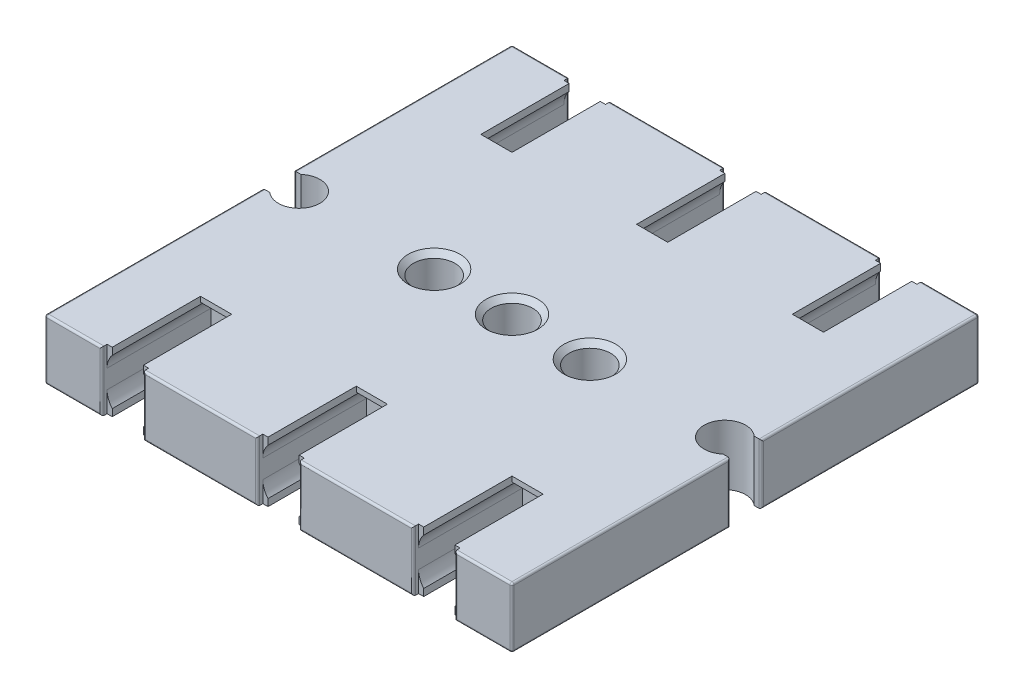
from build123d import *

# Parameters (mm, degrees)
SKETCH_1_W                       = 45
SKETCH_1_H                       = 45
EXTRUDE_1_DEPTH                  = 5.8
CUT_EXTRUDE_1_DEPTH              = 10.5
SKETCH_3_W                       = 4
SKETCH_3_H                       = 5.8
CUT_EXTRUDE_2_DEPTH              = 0.5
SKETCH_4_W                       = 3
SKETCH_4_H                       = 0.5
EXTRUDE_2_DEPTH                  = 1.5
PATTERN_LINEAR_1_COUNT           = 3
PATTERN_LINEAR_1_PITCH           = 15
PATTERN_LINEAR_1_COPY_1_DEPTH    = 10.5
PATTERN_LINEAR_1_COPY_2_DEPTH    = 10.5
PATTERN_LINEAR_1_COPY_3_SKETCH_W = 4
PATTERN_LINEAR_1_COPY_3_SKETCH_H = 5.8
PATTERN_LINEAR_1_COPY_3_DEPTH    = 0.5
PATTERN_LINEAR_1_COPY_4_SKETCH_W = 4
PATTERN_LINEAR_1_COPY_4_SKETCH_H = 5.8
PATTERN_LINEAR_1_COPY_4_DEPTH    = 0.5
PATTERN_LINEAR_1_COPY_5_SKETCH_W = 3
PATTERN_LINEAR_1_COPY_5_SKETCH_H = 0.5
PATTERN_LINEAR_1_COPY_5_DEPTH    = 1.5
PATTERN_LINEAR_1_COPY_6_SKETCH_W = 3
PATTERN_LINEAR_1_COPY_6_SKETCH_H = 0.5
PATTERN_LINEAR_1_COPY_6_DEPTH    = 1.5
CUT_EXTRUDE_3_REACH              = 34.344
SKETCH_5_R                       = 2
CUT_EXTRUDE_4_REACH              = 34.344
SKETCH_6_R                       = 2
CUT_EXTRUDE_5_REACH              = 34.344
CHAMFER_1_SIZE                   = 0.5
FILLET_1_R                       = 0.2


with BuildPart() as part:
    # 草图1 → 凸台-拉伸1 (new body)
    with BuildSketch(Plane(origin=(0, 0, 0), x_dir=(1, 0, 0), z_dir=(0, 1, 0))):
        Rectangle(SKETCH_1_W, SKETCH_1_H)
    extrude(amount=EXTRUDE_1_DEPTH)

    # 草图2 → 切除-拉伸1 (cut)
    with BuildSketch(Plane.XY.offset(22.5)):
        with BuildLine():
            Line((-15, 5.8), (-16.5, 5.8))
            Line((-16.5, 5.8), (-16.5, 5.122875656))
            ThreePointArc((-16.5, 5.122875656), (-16.870828693, 4.507106781), (-17, 3.8))
            Line((-17, 3.8), (-17, 2))
            ThreePointArc((-17, 2), (-16.870828693, 1.292893219), (-16.5, 0.677124344))
            Line((-16.5, 0.677124344), (-16.5, 0))
            Line((-16.5, 0), (-15, 0))
            Line((-15, 0), (-13.5, 0))
            Line((-13.5, 0), (-13.5, 0.677124344))
            ThreePointArc((-13.5, 0.677124344), (-13.129171307, 1.292893219), (-13, 2))
            Line((-13, 2), (-13, 3.8))
            ThreePointArc((-13, 3.8), (-13.129171307, 4.507106781), (-13.5, 5.122875656))
            Line((-13.5, 5.122875656), (-13.5, 5.8))
            Line((-13.5, 5.8), (-15, 5.8))
        make_face()
    cut_extrude_1 = extrude(amount=-CUT_EXTRUDE_1_DEPTH, mode=Mode.SUBTRACT)

    # 草图3 → 切除-拉伸2 (cut)
    with BuildSketch(Plane.XY.offset(22.5)):
        with Locations((-15, 2.9)):
            Rectangle(SKETCH_3_W, SKETCH_3_H)
    cut_extrude_2 = extrude(amount=-CUT_EXTRUDE_2_DEPTH, mode=Mode.SUBTRACT)

    # 草图4 → 凸台-拉伸2 (add)
    with BuildSketch(Plane.XY.offset(12)):
        with Locations((-15, 5.55)):
            Rectangle(SKETCH_4_W, SKETCH_4_H)
        with Locations((-15, 0.25)):
            Rectangle(SKETCH_4_W, SKETCH_4_H)
    extrude_2 = extrude(amount=EXTRUDE_2_DEPTH)

    # 镜向1: 切除-拉伸1, 切除-拉伸2, 凸台-拉伸2 across plane
    add(cut_extrude_1.mirror(Plane.XY), mode=Mode.SUBTRACT)
    add(cut_extrude_2.mirror(Plane.XY), mode=Mode.SUBTRACT)
    add(extrude_2.mirror(Plane.XY))

    # 阵列(线性)1: 切除-拉伸1, 切除-拉伸2, 凸台-拉伸2 ×3
    with Locations(*[(i * PATTERN_LINEAR_1_PITCH, 0, 0) for i in range(1, PATTERN_LINEAR_1_COUNT)]):
        add(cut_extrude_1, mode=Mode.SUBTRACT)
        add(cut_extrude_2, mode=Mode.SUBTRACT)
        add(extrude_2)

    # 阵列(线性)1 copy 1 sketch → 阵列(线性)1 copy 1 (cut)
    with BuildSketch(Plane(origin=(15, 0, -22.5), x_dir=(1, 0, 0), z_dir=(0, 0, -1))):
        with BuildLine():
            Line((-15, -5.8), (-16.5, -5.8))
            Line((-16.5, -5.8), (-16.5, -5.122875656))
            ThreePointArc((-16.5, -5.122875656), (-16.870828693, -4.507106781), (-17, -3.8))
            Line((-17, -3.8), (-17, -2))
            ThreePointArc((-17, -2), (-16.870828693, -1.292893219), (-16.5, -0.677124344))
            Line((-16.5, -0.677124344), (-16.5, 0))
            Line((-16.5, 0), (-15, 0))
            Line((-15, 0), (-13.5, 0))
            Line((-13.5, 0), (-13.5, -0.677124344))
            ThreePointArc((-13.5, -0.677124344), (-13.129171307, -1.292893219), (-13, -2))
            Line((-13, -2), (-13, -3.8))
            ThreePointArc((-13, -3.8), (-13.129171307, -4.507106781), (-13.5, -5.122875656))
            Line((-13.5, -5.122875656), (-13.5, -5.8))
            Line((-13.5, -5.8), (-15, -5.8))
        make_face()
    extrude(amount=-PATTERN_LINEAR_1_COPY_1_DEPTH, mode=Mode.SUBTRACT)

    # 阵列(线性)1 copy 2 sketch → 阵列(线性)1 copy 2 (cut)
    with BuildSketch(Plane(origin=(30, 0, -22.5), x_dir=(1, 0, 0), z_dir=(0, 0, -1))):
        with BuildLine():
            Line((-15, -5.8), (-16.5, -5.8))
            Line((-16.5, -5.8), (-16.5, -5.122875656))
            ThreePointArc((-16.5, -5.122875656), (-16.870828693, -4.507106781), (-17, -3.8))
            Line((-17, -3.8), (-17, -2))
            ThreePointArc((-17, -2), (-16.870828693, -1.292893219), (-16.5, -0.677124344))
            Line((-16.5, -0.677124344), (-16.5, 0))
            Line((-16.5, 0), (-15, 0))
            Line((-15, 0), (-13.5, 0))
            Line((-13.5, 0), (-13.5, -0.677124344))
            ThreePointArc((-13.5, -0.677124344), (-13.129171307, -1.292893219), (-13, -2))
            Line((-13, -2), (-13, -3.8))
            ThreePointArc((-13, -3.8), (-13.129171307, -4.507106781), (-13.5, -5.122875656))
            Line((-13.5, -5.122875656), (-13.5, -5.8))
            Line((-13.5, -5.8), (-15, -5.8))
        make_face()
    extrude(amount=-PATTERN_LINEAR_1_COPY_2_DEPTH, mode=Mode.SUBTRACT)

    # 阵列(线性)1 copy 3 sketch → 阵列(线性)1 copy 3 (cut)
    with BuildSketch(Plane(origin=(15, 0, -22.5), x_dir=(1, 0, 0), z_dir=(0, 0, -1))):
        with Locations((-15, -2.9)):
            Rectangle(PATTERN_LINEAR_1_COPY_3_SKETCH_W, PATTERN_LINEAR_1_COPY_3_SKETCH_H)
    extrude(amount=-PATTERN_LINEAR_1_COPY_3_DEPTH, mode=Mode.SUBTRACT)

    # 阵列(线性)1 copy 4 sketch → 阵列(线性)1 copy 4 (cut)
    with BuildSketch(Plane(origin=(30, 0, -22.5), x_dir=(1, 0, 0), z_dir=(0, 0, -1))):
        with Locations((-15, -2.9)):
            Rectangle(PATTERN_LINEAR_1_COPY_4_SKETCH_W, PATTERN_LINEAR_1_COPY_4_SKETCH_H)
    extrude(amount=-PATTERN_LINEAR_1_COPY_4_DEPTH, mode=Mode.SUBTRACT)

    # 阵列(线性)1 copy 5 sketch → 阵列(线性)1 copy 5 (add)
    with BuildSketch(Plane(origin=(15, 0, -12), x_dir=(1, 0, 0), z_dir=(0, 0, -1))):
        with Locations((-15, -5.55)):
            Rectangle(PATTERN_LINEAR_1_COPY_5_SKETCH_W, PATTERN_LINEAR_1_COPY_5_SKETCH_H)
        with Locations((-15, -0.25)):
            Rectangle(PATTERN_LINEAR_1_COPY_5_SKETCH_W, PATTERN_LINEAR_1_COPY_5_SKETCH_H)
    extrude(amount=PATTERN_LINEAR_1_COPY_5_DEPTH)

    # 阵列(线性)1 copy 6 sketch → 阵列(线性)1 copy 6 (add)
    with BuildSketch(Plane(origin=(30, 0, -12), x_dir=(1, 0, 0), z_dir=(0, 0, -1))):
        with Locations((-15, -5.55)):
            Rectangle(PATTERN_LINEAR_1_COPY_6_SKETCH_W, PATTERN_LINEAR_1_COPY_6_SKETCH_H)
        with Locations((-15, -0.25)):
            Rectangle(PATTERN_LINEAR_1_COPY_6_SKETCH_W, PATTERN_LINEAR_1_COPY_6_SKETCH_H)
    extrude(amount=PATTERN_LINEAR_1_COPY_6_DEPTH)

    # 草图5 → 切除-拉伸3 (cut, up to next)
    with BuildSketch(Plane(origin=(0, 5.8, 0), x_dir=(1, 0, 0), z_dir=(0, 1, 0)), mode=Mode.PRIVATE) as cut_extrude_3_sk1:
        with Locations(Location((0, 0, 0), (0, 0, 270))):
            Circle(SKETCH_5_R)
    cut_extrude_3_tool1 = extrude(cut_extrude_3_sk1.sketch, amount=-CUT_EXTRUDE_3_REACH, mode=Mode.PRIVATE) & part.part
    add(cut_extrude_3_tool1.solids().sort_by_distance((0, 5.8, 0))[0], mode=Mode.SUBTRACT)

    # 草图6 → 切除-拉伸4 (cut, up to next)
    with BuildSketch(Plane(origin=(0, 5.8, 0), x_dir=(1, 0, 0), z_dir=(0, 1, 0)), mode=Mode.PRIVATE) as cut_extrude_4_sk1:
        with Locations(Location((-7.5, 0, 0), (0, 0, 270))):
            Circle(SKETCH_6_R)
    cut_extrude_4_tool1 = extrude(cut_extrude_4_sk1.sketch, amount=-CUT_EXTRUDE_4_REACH, mode=Mode.PRIVATE) & part.part
    cut_extrude_4 = cut_extrude_4_tool1.solids().sort_by_distance((-7.5, 5.8, 0))[0]
    add(cut_extrude_4, mode=Mode.SUBTRACT)

    # 镜向2: 切除-拉伸4 across plane
    add(cut_extrude_4.mirror(Plane(origin=(0, 0, 0), x_dir=(0, 0, 1), z_dir=(1, 0, 0))), mode=Mode.SUBTRACT)

    # 草图7 → 切除-拉伸5 (cut, up to next)
    with BuildSketch(Plane(origin=(0, 5.8, 0), x_dir=(1, 0, 0), z_dir=(0, 1, 0)), mode=Mode.PRIVATE) as cut_extrude_5_sk1:
        with BuildLine():
            Line((-22.5, -1.5), (-22.5, 1.5))
            Line((-22.5, 1.5), (-21.822875656, 1.5))
            ThreePointArc((-21.822875656, 1.5), (-18.5, 0), (-21.822875656, -1.5))
            Line((-21.822875656, -1.5), (-22.5, -1.5))
        make_face()
    cut_extrude_5_tool1 = extrude(cut_extrude_5_sk1.sketch, amount=-CUT_EXTRUDE_5_REACH, mode=Mode.PRIVATE) & part.part
    cut_extrude_5 = cut_extrude_5_tool1.solids().sort_by_distance((-20.585293, 5.8, 0))[0]
    add(cut_extrude_5, mode=Mode.SUBTRACT)

    # 镜向3: 切除-拉伸5 across plane
    add(cut_extrude_5.mirror(Plane(origin=(0, 0, 0), x_dir=(0, 0, 1), z_dir=(1, 0, 0))), mode=Mode.SUBTRACT)

    # 倒角1
    chamfer_1_edges = [part.edges().sort_by_distance(p)[0] for p in [
        (0, 5.8, -2),
        (0, 0, -2),
        (-7.5, 5.8, -2),
        (-7.5, 0, -2),
        (7.5, 5.8, -2),
        (7.5, 0, -2),
    ]]
    chamfer(chamfer_1_edges, length=CHAMFER_1_SIZE)

    # 圆角1
    fillet_1_edges = [part.edges().sort_by_distance(p)[0] for p in [
        (-19.75, 5.8, 22.5),
        (22.5, 5.8, 12),
        (-17, 2.9, -22.5),
        (-13, 2.9, -22.5),
        (-19.75, 0, -22.5),
        (-19.75, 5.8, -22.5),
        (-2, 2.9, -22.5),
        (2, 2.9, -22.5),
        (-17, 2.9, 22.5),
        (-7.5, 0, -22.5),
        (-7.5, 5.8, -22.5),
        (-13, 2.9, 22.5),
        (13, 2.9, -22.5),
        (17, 2.9, -22.5),
        (7.5, 0, -22.5),
        (7.5, 5.8, -22.5),
        (19.75, 5.8, -22.5),
        (22.5, 0, 12),
        (-2, 2.9, 22.5),
        (2, 2.9, 22.5),
        (-19.75, 0, 22.5),
        (13, 2.9, 22.5),
        (17, 2.9, 22.5),
        (-22.5, 0, -12),
        (7.5, 0, 22.5),
        (7.5, 5.8, 22.5),
        (19.75, 0, -22.5),
        (19.75, 0, 22.5),
        (-7.5, 0, 22.5),
        (19.75, 5.8, 22.5),
        (-7.5, 5.8, 22.5),
        (-22.5, 5.8, -12),
        (-22.5, 0, 12),
        (-22.5, 5.8, 12),
        (-22.5, 2.9, 1.5),
        (-22.5, 2.9, -1.5),
        (22.5, 0, -12),
        (22.5, 5.8, -12),
        (22.5, 2.9, 1.5),
        (22.5, 2.9, -1.5),
        (22.5, 2.9, -22.5),
        (22.5, 2.9, 22.5),
        (-22.5, 2.9, 22.5),
        (-22.5, 2.9, -22.5),
    ]]
    fillet(fillet_1_edges, radius=FILLET_1_R)


solid = part.part
